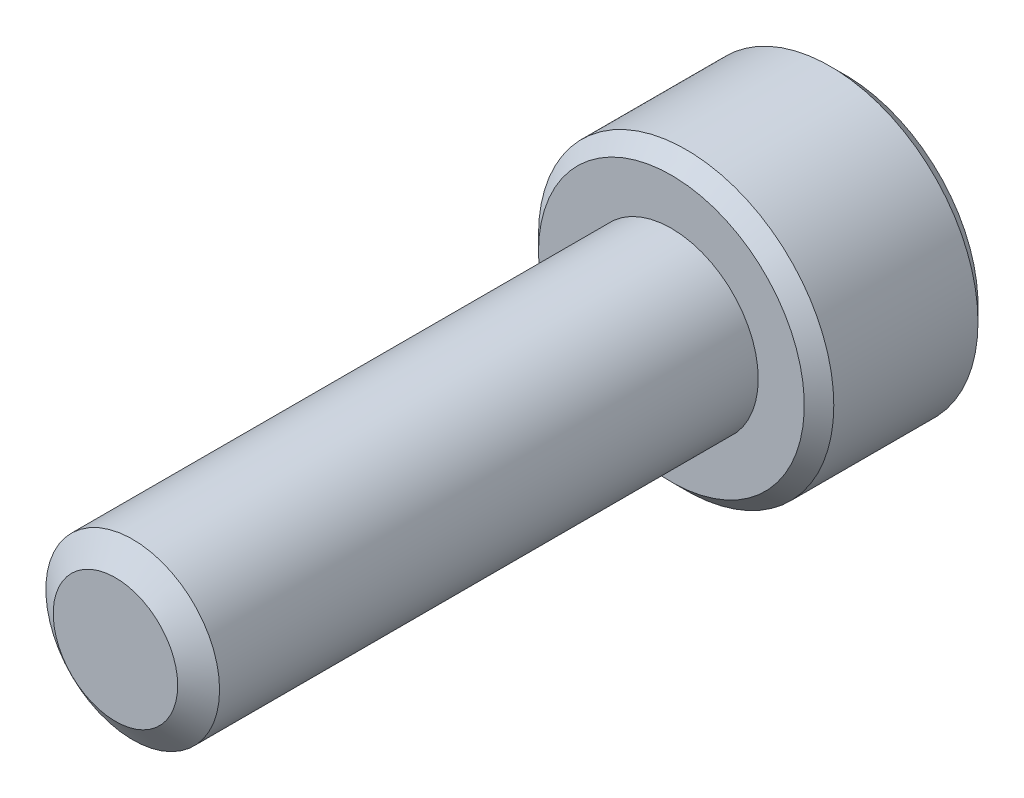
from build123d import *

# Parameters (mm, degrees)
SKETCH1_R          = 2.5
EXTRUDE1_DEPTH     = 16
SKETCH6_R          = 4.25
EXTRUDE2_DEPTH     = 5
CUT_EXTRUDE1_DEPTH = 3
CHAMFER1_SIZE      = 0.425


with BuildPart() as part:
    # Sketch1 → Extrude1 (new body)
    with BuildSketch(Plane.XY):
        Circle(SKETCH1_R)
    extrude(amount=-EXTRUDE1_DEPTH)

    # Sketch4 → Cut-Revolve1 (revolve, cut)
    with BuildSketch(Plane(origin=(0, 0, 0), x_dir=(0, 0, -1), z_dir=(1, 0, 0))):
        Polygon((0.496211411, 2.5), (0, 1.791336663), (0, 2.5), align=None)
    revolve(axis=Axis((0, 0, 0), (0, 0, -1)), mode=Mode.SUBTRACT)

    # Sketch6 → Extrude2 (add)
    with BuildSketch(Plane(origin=(0, 0, -16), x_dir=(-1, 0, 0), z_dir=(0, 0, -1))):
        Circle(SKETCH6_R)
    extrude(amount=EXTRUDE2_DEPTH)

    # Sketch7 → Cut-Extrude1 (cut)
    with BuildSketch(Plane(origin=(0, 0, -21), x_dir=(-1, 0, 0), z_dir=(0, 0, -1))):
        Polygon((0, 2.309401077), (-2, 1.154700538), (-2, -1.154700538), (0, -2.309401077), (2, -1.154700538), (2, 1.154700538), align=None)
    extrude(amount=-CUT_EXTRUDE1_DEPTH, mode=Mode.SUBTRACT)

    # Cut-Extrude2 cone 1 section (through the dimple's axis) → Cut-Extrude2 (revolve, cut)
    with BuildSketch(Plane(origin=(0, 0, -21), x_dir=(0, 1, 0), z_dir=(1, 0, 0))):
        Polygon((0, 0), (2.309401077, 0), (0, 2.309401077), align=None)
    revolve(axis=Axis((0, 0, -21), (0, 0, 1)), mode=Mode.SUBTRACT)

    # Chamfer1
    chamfer1_edges = [part.edges().sort_by_distance(p)[0] for p in [
        (4.25, 0, -21),
        (4.25, 0, -16),
    ]]
    chamfer(chamfer1_edges, length=CHAMFER1_SIZE)


solid = part.part
